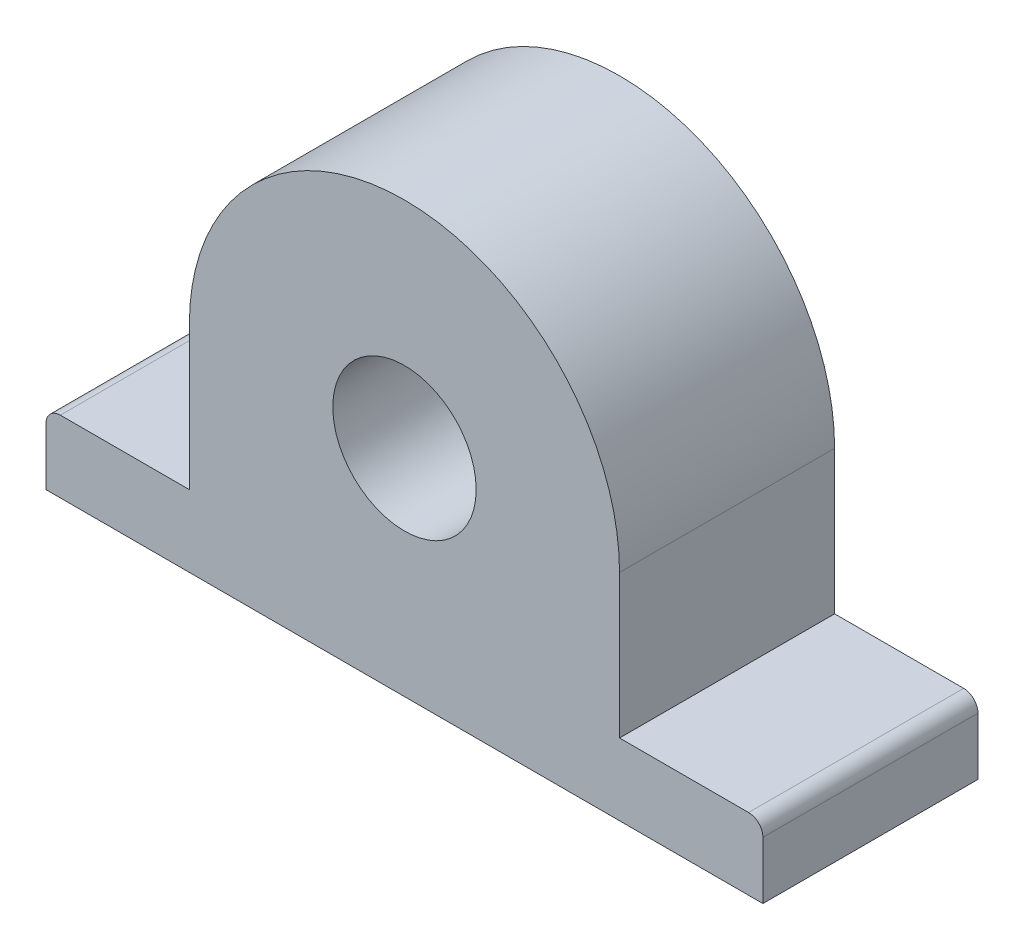
from build123d import *

# Parameters (mm, degrees)
SKETCH_1_R      = 5
EXTRUDE_1_DEPTH = 15
FILLET_1_R      = 1


with BuildPart() as part:
    # 草图1 → 凸台-拉伸1 (new body)
    with BuildSketch(Plane.XY):
        with BuildLine():
            Line((15, 2.5), (25, 2.5))
            Line((25, 2.5), (25, -2.5))
            Line((25, -2.5), (-25, -2.5))
            Line((-25, -2.5), (-25, 2.5))
            Line((-25, 2.5), (-15, 2.5))
            Line((-15, 2.5), (-15, 12.5))
            ThreePointArc((-15, 12.5), (0, 27.5), (15, 12.5))
            Line((15, 12.5), (15, 2.5))
        make_face()
        with Locations((0, 12.5)):
            Circle(SKETCH_1_R, mode=Mode.SUBTRACT)
    extrude(amount=EXTRUDE_1_DEPTH)

    # 圆角1
    fillet_1_edges = [part.edges().sort_by_distance(p)[0] for p in [
        (-25, 2.5, 7.5),
        (25, 2.5, 7.5),
    ]]
    fillet(fillet_1_edges, radius=FILLET_1_R)


solid = part.part
